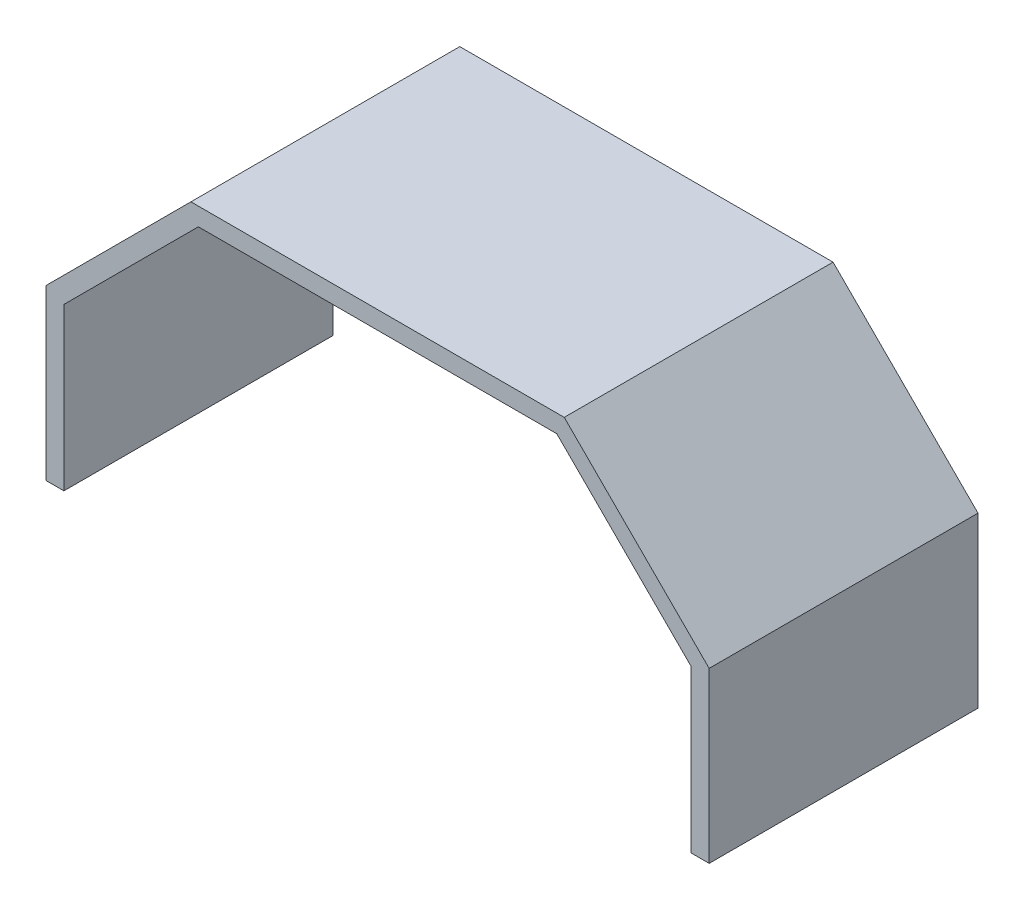
from build123d import *

# Parameters (mm, degrees)
BOSS_EXTRUDE1_DEPTH = 30


with BuildPart() as part:
    # Sketch2 → Boss-Extrude1 (new body)
    with BuildSketch(Plane.XY):
        Polygon((37, 13.565874344), (35, 13.565874344), (35, 31.586782193), (20, 46.586782193), (-20, 46.586782193), (-35, 31.586782193), (-35, 13.565874344), (-37, 13.565874344), (-37, 32.415209318), (-20.828427125, 48.586782193), (20.828427125, 48.586782193), (37, 32.415209318), align=None)
    extrude(amount=BOSS_EXTRUDE1_DEPTH)


solid = part.part
